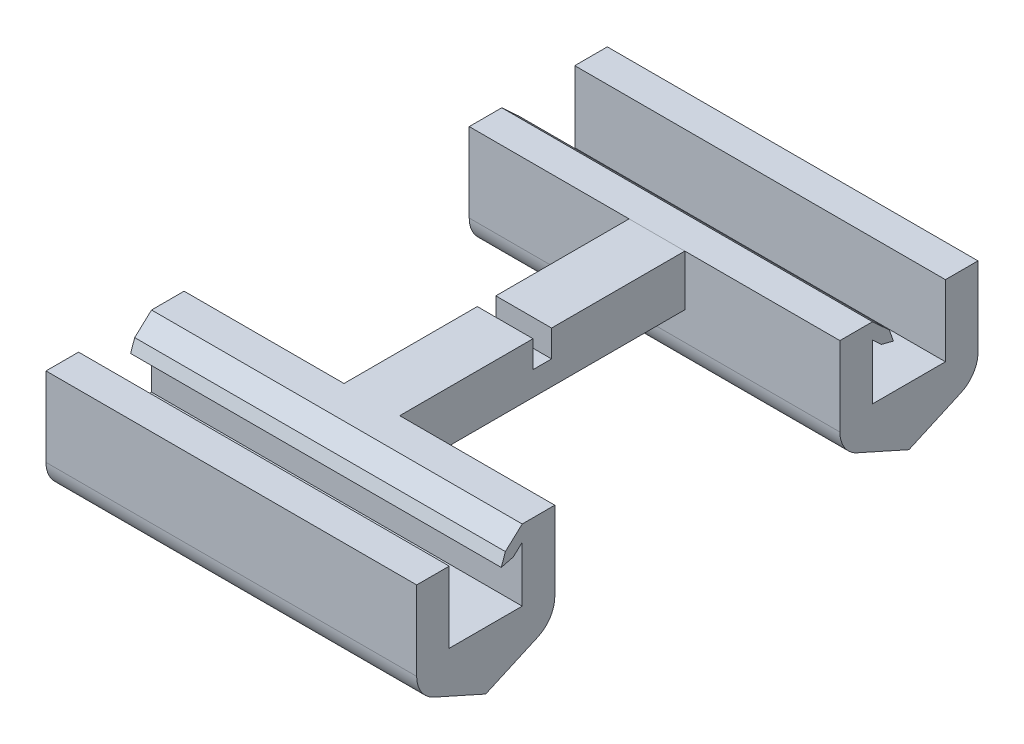
from build123d import *

# Parameters (mm, degrees)
BOSS_EXTRUDE1_DEPTH   = 12.7
BOSS_EXTRUDE1_2_DEPTH = 12.7
BOSS_EXTRUDE2_REACH   = 21.776
SKETCH3_W             = 0.635
SKETCH3_H             = 0.917188339
CUT_EXTRUDE1_DEPTH    = 1.90971


with BuildPart() as part:
    # Sketch1 → Boss-Extrude1 (new body)
    with BuildSketch(Plane(origin=(0, 0, 0), x_dir=(0, 0, -1), z_dir=(1, 0, 0))):
        with BuildLine():
            Line((6.30611145, -0.825095556), (6, -0.543502834))
            Line((6, -0.543502834), (6, -2.437418567))
            Line((6, -2.437418567), (8.5, -2.437418567))
            Line((8.5, -2.437418567), (8.5, 0))
            Line((8.5, 0), (9.615854332, 0))
            Line((9.615854332, 0), (9.615854332, -2.713473186))
            ThreePointArc((9.615854332, -2.713473186), (9.455087427, -3.257245023), (9.02447871, -3.62617583))
            Line((9.02447871, -3.62617583), (7.25, -4.420624343))
            Line((7.25, -4.420624343), (5.47552129, -3.62617583))
            ThreePointArc((5.47552129, -3.62617583), (5.044912573, -3.257245023), (4.884145668, -2.713473186))
            Line((4.884145668, -2.713473186), (4.884145668, 0))
            Line((4.884145668, 0), (6, 0))
            Line((6, 0), (6.576918535, -0.530708867))
            Line((6.576918535, -0.530708867), (6.717048019, -0.931365761))
            Line((6.717048019, -0.931365761), (6.30611145, -0.825095556))
        make_face()
    extrude(amount=BOSS_EXTRUDE1_DEPTH)


with BuildPart() as body_2:
    # Sketch1 → Boss-Extrude1 2 (new body)
    with BuildSketch(Plane(origin=(0, 0, 0), x_dir=(0, 0, -1), z_dir=(1, 0, 0))):
        with BuildLine():
            Line((-6, 0), (-4.884145668, 0))
            Line((-4.884145668, 0), (-4.884145668, -2.713473186))
            ThreePointArc((-4.884145668, -2.713473186), (-5.044912573, -3.257245023), (-5.47552129, -3.62617583))
            Line((-5.47552129, -3.62617583), (-7.25, -4.420624343))
            Line((-7.25, -4.420624343), (-9.02447871, -3.62617583))
            ThreePointArc((-9.02447871, -3.62617583), (-9.455087427, -3.257245023), (-9.615854332, -2.713473186))
            Line((-9.615854332, -2.713473186), (-9.615854332, 0))
            Line((-9.615854332, 0), (-8.5, 0))
            Line((-8.5, 0), (-8.5, -2.437418567))
            Line((-8.5, -2.437418567), (-6, -2.437418567))
            Line((-6, -2.437418567), (-6, -0.543502834))
            Line((-6, -0.543502834), (-6.30611145, -0.825095556))
            Line((-6.30611145, -0.825095556), (-6.717048019, -0.931365761))
            Line((-6.717048019, -0.931365761), (-6.576918535, -0.530708867))
            Line((-6.576918535, -0.530708867), (-6, 0))
        make_face()
    extrude(amount=BOSS_EXTRUDE1_2_DEPTH)

    # Sketch2 → Boss-Extrude2 (add, up to next)
    with BuildSketch(Plane.XY.offset(-4.884145668), mode=Mode.PRIVATE) as boss_extrude2_sk1:
        Polygon((5.47811731, 0), (7.387826905, 0), (7.387826905, -1.741683954), (6.432972108, -2.696538752), (5.47811731, -1.741683954), align=None)
    boss_extrude2_tool1 = extrude(boss_extrude2_sk1.sketch, amount=BOSS_EXTRUDE2_REACH, mode=Mode.PRIVATE) - body_2.part
    add(boss_extrude2_tool1.solids().sort_by_distance((6.432972, -1.126675, -4.884146))[0])

    # Sketch3 → Cut-Extrude1 (cut)
    with BuildSketch(Plane.ZY.offset(-5.47811731)):
        with Locations((0, -0.45859417)):
            Rectangle(SKETCH3_W, SKETCH3_H)
    extrude(amount=-CUT_EXTRUDE1_DEPTH, mode=Mode.SUBTRACT)


solid = Compound([part.part, body_2.part])
